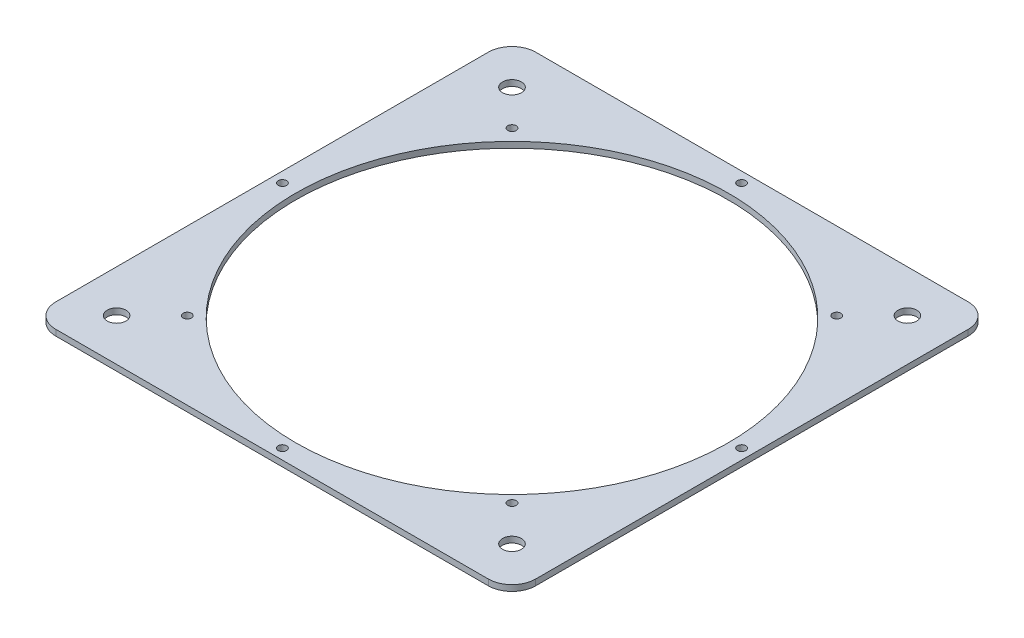
from build123d import *

# Parameters (mm, degrees)
SKETCH1_W               = 257.175
SKETCH1_H               = 257.175
BOSS_EXTRUDE1_DEPTH     = 3.175
SKETCH2_R               = 115.8875
CUT_EXTRUDE1_DEPTH      = 3.175
F_8_CLEARANCE_HOLE1_D   = 4.4958
FILLET1_R               = 12.7
F_3_8_CLEARANCE_HOLE1_D = 10.0838


with BuildPart() as part:
    # Sketch1 → Boss-Extrude1 (new body)
    with BuildSketch(Plane(origin=(0, 0, 0), x_dir=(1, 0, 0), z_dir=(0, 1, 0))):
        Rectangle(SKETCH1_W, SKETCH1_H)
    extrude(amount=BOSS_EXTRUDE1_DEPTH)

    # Sketch2 → Cut-Extrude1 (cut)
    with BuildSketch(Plane(origin=(0, 3.175, 0), x_dir=(1, 0, 0), z_dir=(0, 1, 0))):
        with Locations(Location((1.096399637, -1.096399637, 0), (0, 0, 270))):
            Circle(SKETCH2_R)
    extrude(amount=-CUT_EXTRUDE1_DEPTH, mode=Mode.SUBTRACT)

    # #8 Clearance Hole1 (through all)
    with Locations(Plane(origin=(0, 3.175, 0), x_dir=(1, 0, 0), z_dir=(0, 1, 0))):
        with Locations((87.000721301, -87.000721301), (123.0376, 0), (87.000721301, 87.000721301), (0, 123.0376), (-87.000721301, 87.000721301), (-123.0376, 0), (-87.000721301, -87.000721301), (0, -123.0376)):
            Hole(F_8_CLEARANCE_HOLE1_D / 2)

    # Fillet1
    fillet1_edges = [part.edges().sort_by_distance(p)[0] for p in [
        (128.5875, 1.5875, 128.5875),
        (-128.5875, 1.5875, 128.5875),
        (-128.5875, 1.5875, -128.5875),
        (128.5875, 1.5875, -128.5875),
    ]]
    fillet(fillet1_edges, radius=FILLET1_R)

    # 3/8 Clearance Hole1 (through all)
    with Locations(Plane(origin=(0, 3.175, 0), x_dir=(1, 0, 0), z_dir=(0, 1, 0))):
        with Locations((105.934238711, -105.934238711), (105.934238711, 105.934238711), (-105.934238711, -105.934238711), (-105.934238711, 105.934238711)):
            Hole(F_3_8_CLEARANCE_HOLE1_D / 2)


solid = part.part
